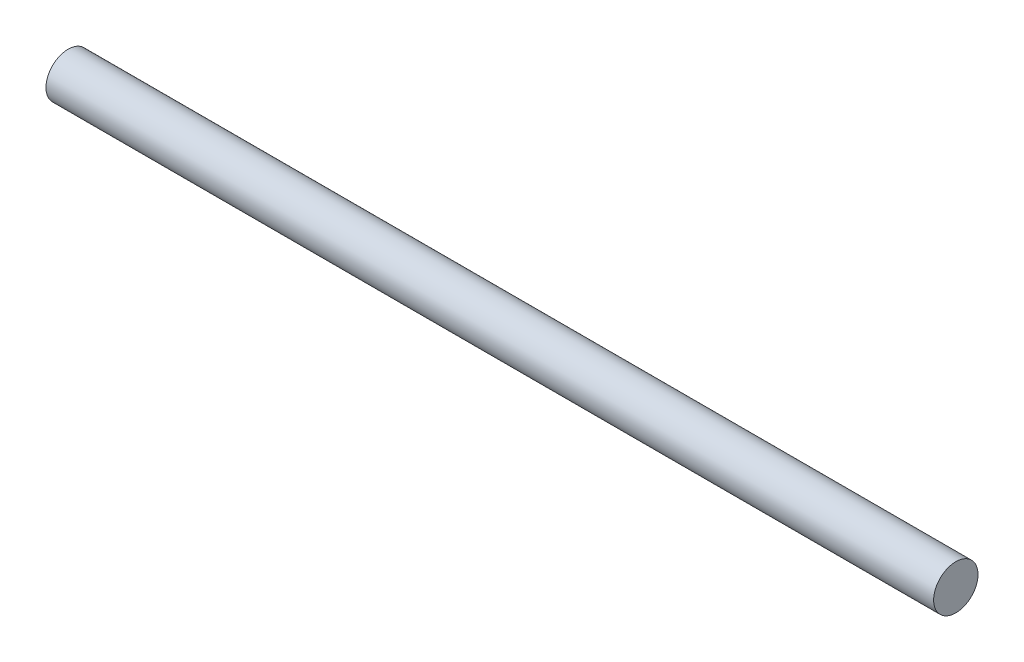
from build123d import *

# Parameters (mm, degrees)
SKETCH1_R           = 1
BOSS_EXTRUDE1_DEPTH = 20


with BuildPart() as part:
    # Sketch1 → Boss-Extrude1 (new, symmetric)
    with BuildSketch(Plane(origin=(0, 0, 0), x_dir=(0, 0, -1), z_dir=(1, 0, 0))):
        Circle(SKETCH1_R)
    extrude(amount=BOSS_EXTRUDE1_DEPTH, both=True)


solid = part.part
